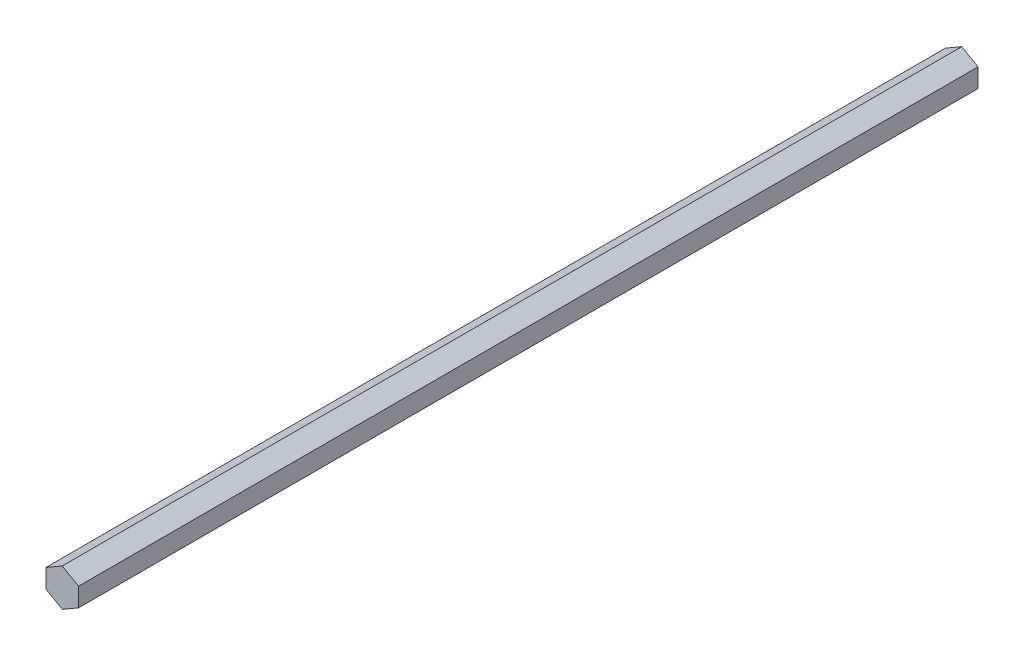
from build123d import *

# Parameters (mm, degrees)
BOSS_EXTRUDE2_DEPTH      = 152.4
BOSS_EXTRUDE2_DEPTH_BACK = 152.4
BOSS_EXTRUDE3_DEPTH      = 46.228


with BuildPart() as part:
    # Sketch3 → Boss-Extrude2 (new, two sides: drawn at the far end of the back side and taken through both)
    with BuildSketch(Plane.XY.offset(-BOSS_EXTRUDE2_DEPTH_BACK)):
        Polygon((-6.35, -3.666174209), (0, -7.332348419), (6.35, -3.666174209), (6.35, 3.666174209), (0, 7.332348419), (-6.35, 3.666174209), align=None)
    extrude(amount=BOSS_EXTRUDE2_DEPTH + BOSS_EXTRUDE2_DEPTH_BACK)

    # Sketch4 → Boss-Extrude3 (add)
    with BuildSketch(Plane.XY.offset(152.4)):
        Polygon((-6.35, 3.666174209), (-6.35, -3.666174209), (0, -7.332348419), (6.35, -3.666174209), (6.35, 3.666174209), (0, 7.332348419), align=None)
    extrude(amount=BOSS_EXTRUDE3_DEPTH)


solid = part.part
